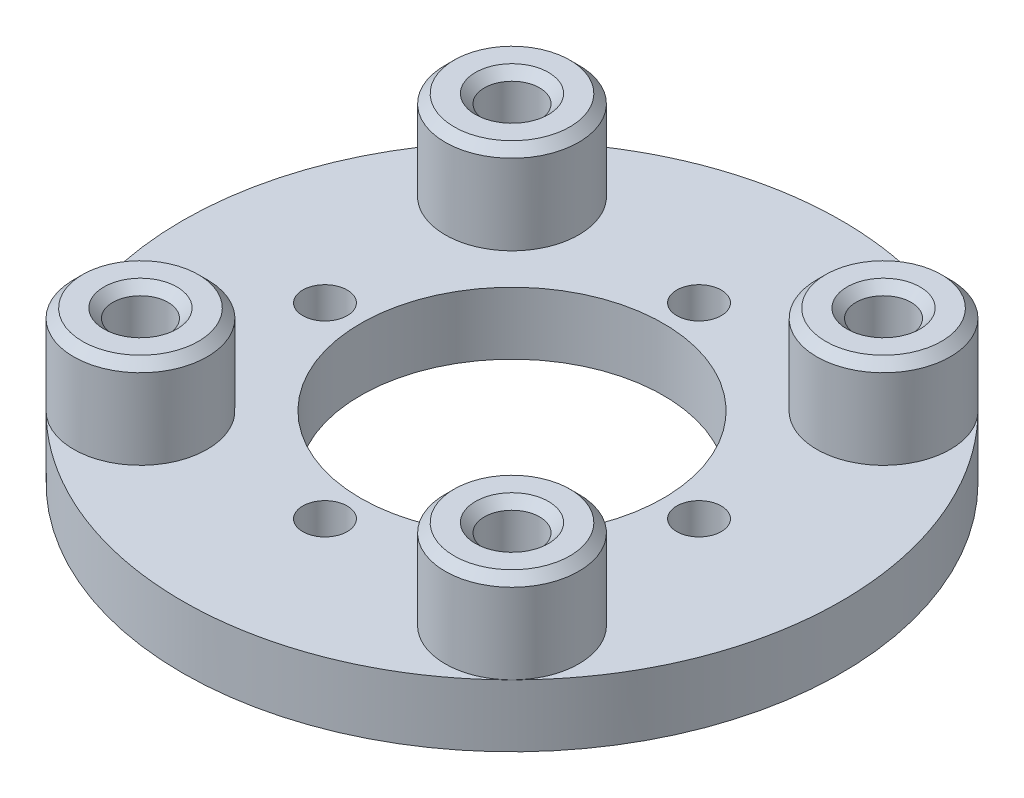
from build123d import *

# Parameters (mm, degrees)
SKETCH_1_R          = 37
SKETCH_1_R_2        = 2.5
SKETCH_1_R_3        = 17
EXTRUDE_1_DEPTH     = 7
SKETCH_4_R          = 7.5
EXTRUDE_9_DEPTH     = 10
CUT_EXTRUDE_1_REACH = 57.018
SKETCH_2_R          = 3.1
CHAMFER_1_SIZE      = 1


with BuildPart() as part:
    # 草图1 → 凸台-拉伸1 (new body)
    with BuildSketch(Plane(origin=(0, 0, 0), x_dir=(1, 0, 0), z_dir=(0, 1, 0))):
        with Locations(Location((0, 0, 0), (0, 0, 270))):
            Circle(SKETCH_1_R)
        with Locations(Location((21, 0, 0), (0, 0, 270))):
            Circle(SKETCH_1_R_2, mode=Mode.SUBTRACT)
        with Locations(Location((0, -21, 0), (0, 0, 270))):
            Circle(SKETCH_1_R_2, mode=Mode.SUBTRACT)
        with Locations(Location((-21, 0, 0), (0, 0, 270))):
            Circle(SKETCH_1_R_2, mode=Mode.SUBTRACT)
        with Locations(Location((0, 21, 0), (0, 0, 270))):
            Circle(SKETCH_1_R_2, mode=Mode.SUBTRACT)
        with Locations(Location((0, 0, 0), (0, 0, 270))):
            Circle(SKETCH_1_R_3, mode=Mode.SUBTRACT)
    extrude(amount=EXTRUDE_1_DEPTH)

    # 草图4 → 凸台-拉伸9 (add)
    with BuildSketch(Plane(origin=(0, 7, 0), x_dir=(1, 0, 0), z_dir=(0, 1, 0))):
        with Locations(Location((20.859650045, -20.859650045, 0), (0, 0, 314.999668768))):
            Circle(SKETCH_4_R)
        with Locations(Location((-20.859650045, -20.859650045, 0), (0, 0, 224.999668649))):
            Circle(SKETCH_4_R)
        with Locations(Location((-20.859650045, 20.859650045, 0), (0, 0, 134.999668649))):
            Circle(SKETCH_4_R)
        with Locations(Location((20.859650045, 20.859650045, 0), (0, 0, 44.999668649))):
            Circle(SKETCH_4_R)
    extrude(amount=EXTRUDE_9_DEPTH)

    # 草图2 → 切除-拉伸1 (cut, up to next)
    with BuildSketch(Plane.XZ, mode=Mode.PRIVATE) as cut_extrude_1_sk1:
        with Locations(Location((20.859650045, 20.859650045, 0), (0, 0, 270))):
            Circle(SKETCH_2_R)
    cut_extrude_1_tool1 = extrude(cut_extrude_1_sk1.sketch, amount=-CUT_EXTRUDE_1_REACH, mode=Mode.PRIVATE) & part.part
    # 草图2 → 切除-拉伸1 (cut, up to next)
    with BuildSketch(Plane.XZ, mode=Mode.PRIVATE) as cut_extrude_1_sk2:
        with Locations(Location((20.859650045, -20.859650045, 0), (0, 0, 270))):
            Circle(SKETCH_2_R)
    cut_extrude_1_tool2 = extrude(cut_extrude_1_sk2.sketch, amount=-CUT_EXTRUDE_1_REACH, mode=Mode.PRIVATE) & part.part
    # 草图2 → 切除-拉伸1 (cut, up to next)
    with BuildSketch(Plane.XZ, mode=Mode.PRIVATE) as cut_extrude_1_sk3:
        with Locations(Location((-20.859650045, -20.859650045, 0), (0, 0, 270))):
            Circle(SKETCH_2_R)
    cut_extrude_1_tool3 = extrude(cut_extrude_1_sk3.sketch, amount=-CUT_EXTRUDE_1_REACH, mode=Mode.PRIVATE) & part.part
    # 草图2 → 切除-拉伸1 (cut, up to next)
    with BuildSketch(Plane.XZ, mode=Mode.PRIVATE) as cut_extrude_1_sk4:
        with Locations(Location((-20.859650045, 20.859650045, 0), (0, 0, 270))):
            Circle(SKETCH_2_R)
    cut_extrude_1_tool4 = extrude(cut_extrude_1_sk4.sketch, amount=-CUT_EXTRUDE_1_REACH, mode=Mode.PRIVATE) & part.part
    add(cut_extrude_1_tool1.solids().sort_by_distance((20.85965, 0, 20.85965))[0], mode=Mode.SUBTRACT)
    add(cut_extrude_1_tool2.solids().sort_by_distance((20.85965, 0, -20.85965))[0], mode=Mode.SUBTRACT)
    add(cut_extrude_1_tool3.solids().sort_by_distance((-20.85965, 0, -20.85965))[0], mode=Mode.SUBTRACT)
    add(cut_extrude_1_tool4.solids().sort_by_distance((-20.85965, 0, 20.85965))[0], mode=Mode.SUBTRACT)

    # 倒角1
    chamfer_1_edges = [part.edges().sort_by_distance(p)[0] for p in [
        (15.556379845, 17, 15.556318527),
        (-15.556318516, 17, 15.556379856),
        (-15.556379856, 17, -15.556318516),
        (15.556318516, 17, -15.556379856),
        (-20.859650045, 17, 23.959650045),
        (-20.859650045, 0, 23.959650045),
        (-20.859650045, 17, -17.759650045),
        (-20.859650045, 0, -17.759650045),
        (20.859650045, 17, -17.759650045),
        (20.859650045, 0, -17.759650045),
        (20.859650045, 17, 23.959650045),
        (20.859650045, 0, 23.959650045),
    ]]
    chamfer(chamfer_1_edges, length=CHAMFER_1_SIZE)


solid = part.part
